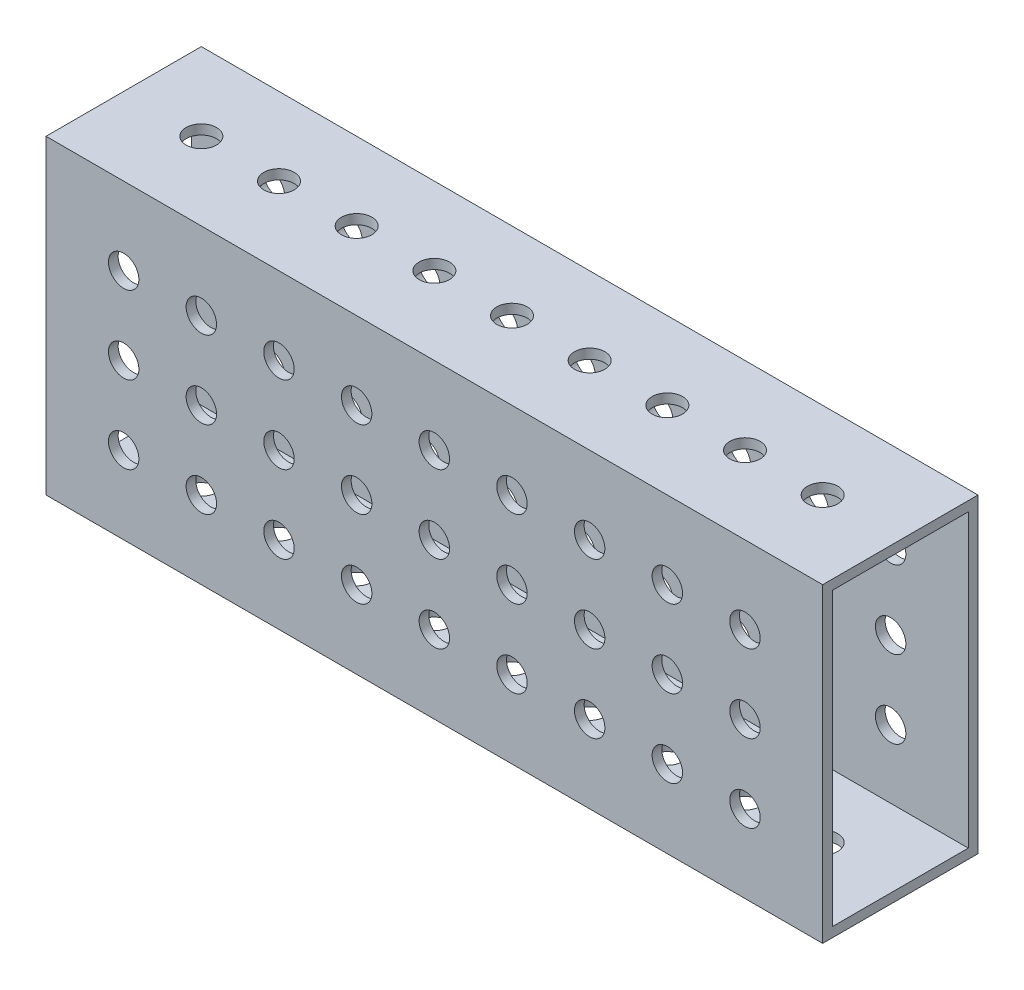
from build123d import *

# Parameters (mm, degrees)
SKETCH1_W           = 127
SKETCH1_H           = 50.8
BOSS_EXTRUDE1_DEPTH = 12.7
SHELL1_T            = -1.5875
SKETCH2_R           = 2.4892
CUT_EXTRUDE1_DEPTH  = 140.121529606
SKETCH3_R           = 2.4892
CUT_EXTRUDE2_DEPTH  = 138.371503595
LPATTERN1_COUNT     = 9
LPATTERN1_PITCH     = 12.7


with BuildPart() as part:
    # Sketch1 → Boss-Extrude1 (new, symmetric)
    with BuildSketch(Plane.XY):
        with Locations((63.5, 25.4)):
            Rectangle(SKETCH1_W, SKETCH1_H)
    extrude(amount=BOSS_EXTRUDE1_DEPTH, both=True)

    # Shell1
    shell1_openings = [part.faces().sort_by_distance(p)[0] for p in [
        (127, 25.4, 0),
        (0, 25.4, 0),
    ]]
    offset(amount=SHELL1_T, openings=shell1_openings, kind=Kind.INTERSECTION)

    # Sketch2 → Cut-Extrude1 (cut, through all)
    with BuildSketch(Plane(origin=(0, 0, -12.7), x_dir=(-1, 0, 0), z_dir=(0, 0, -1))):
        with Locations((-114.3, 38.1)):
            Circle(SKETCH2_R)
        with Locations((-114.3, 25.4)):
            Circle(SKETCH2_R)
        with Locations((-114.3, 12.7)):
            Circle(SKETCH2_R)
    cut_extrude1 = extrude(amount=-CUT_EXTRUDE1_DEPTH, mode=Mode.SUBTRACT)

    # Sketch3 → Cut-Extrude2 (cut, through all)
    with BuildSketch(Plane(origin=(0, 50.8, 0), x_dir=(1, 0, 0), z_dir=(0, 1, 0))):
        with Locations(Location((114.3, 0, 0), (0, 0, 270))):
            Circle(SKETCH3_R)
    cut_extrude2 = extrude(amount=-CUT_EXTRUDE2_DEPTH, mode=Mode.SUBTRACT)

    # LPattern1: Cut-Extrude1, Cut-Extrude2 ×9
    with Locations(*[(-i * LPATTERN1_PITCH, 0, 0) for i in range(1, LPATTERN1_COUNT)]):
        add(cut_extrude1, mode=Mode.SUBTRACT)
        add(cut_extrude2, mode=Mode.SUBTRACT)


solid = part.part
